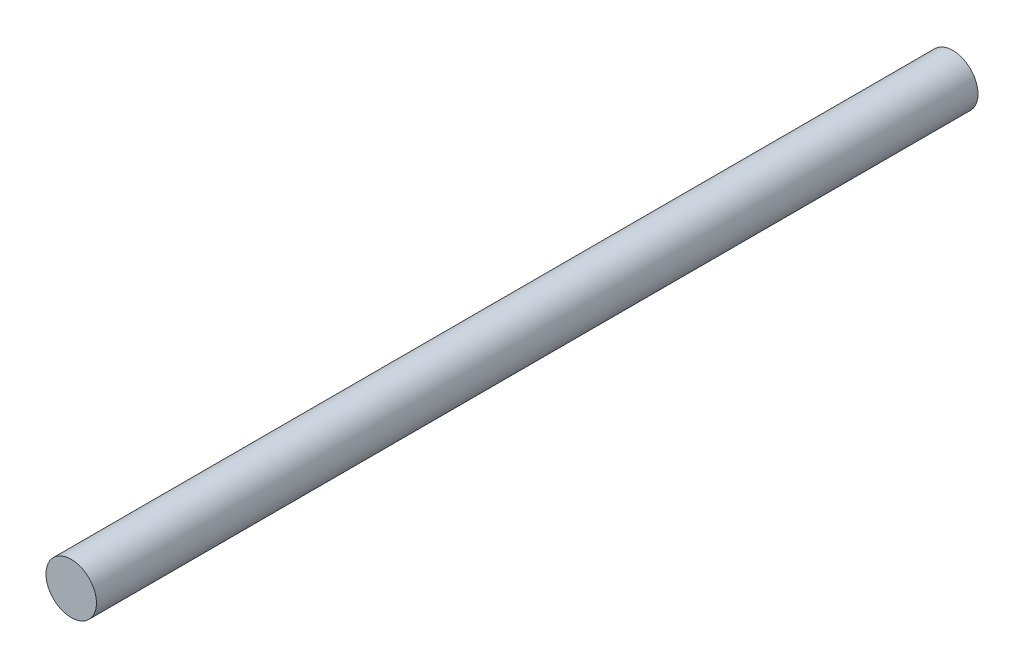
from build123d import *

# Parameters (mm, degrees)
SKETCH1_R           = 4
BOSS_EXTRUDE1_DEPTH = 139.7


with BuildPart() as part:
    # Sketch1 → Boss-Extrude1 (new body)
    with BuildSketch(Plane.XY):
        Circle(SKETCH1_R)
    extrude(amount=BOSS_EXTRUDE1_DEPTH)


solid = part.part
